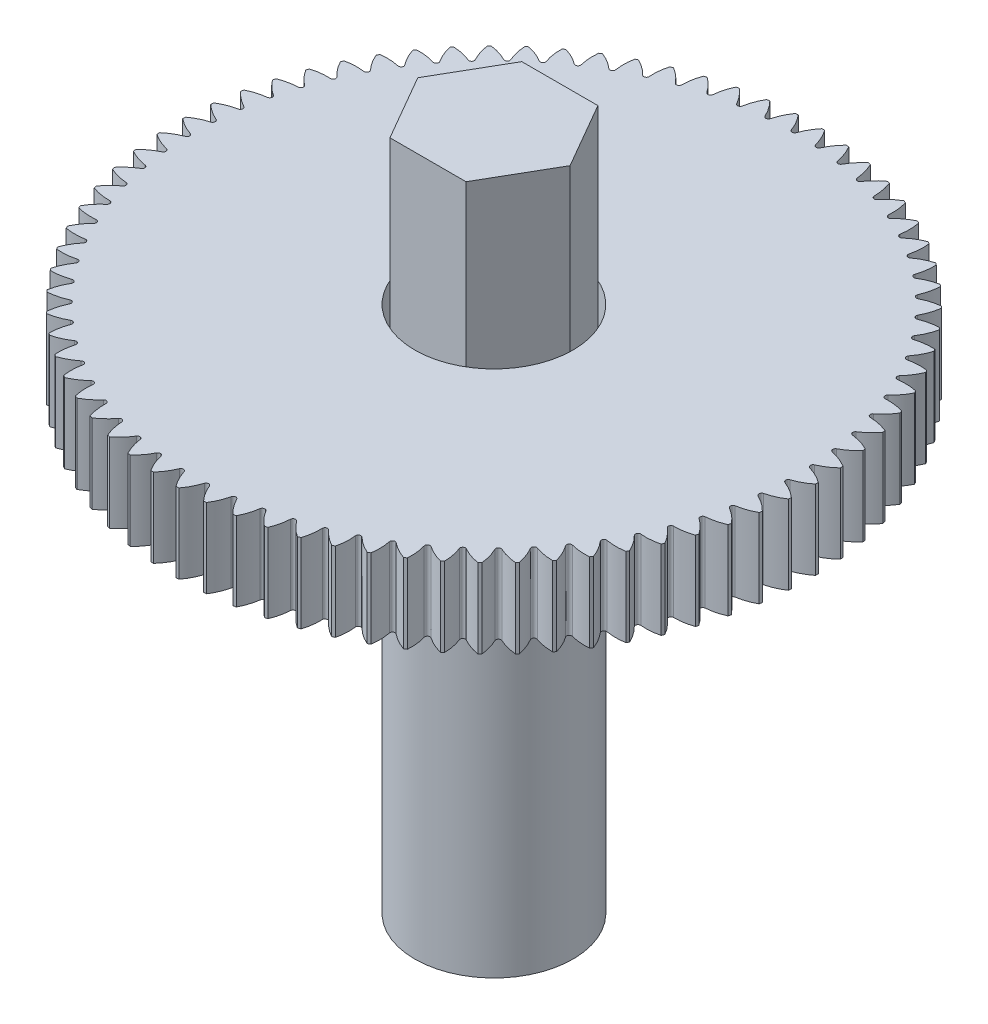
from build123d import *

# Parameters (mm, degrees)
CUT_EXTRUDE1_DEPTH = 3
SKETCH7_R          = 3
CUT_EXTRUDE9_DEPTH = 9


with BuildPart() as part:
    # Sketch1 → Revolve1 (revolve)
    with BuildSketch(Plane.XY, mode=Mode.PRIVATE) as revolve1_sk:
        Polygon((0, 13), (0, -13), (3, -13), (3, 4), (12, 4), (12, 7), (3, 7), (3, 13), align=None)
    revolve(revolve1_sk.sketch.rotate(Axis((0, 13, 0), (0, -1, 0)), 90), axis=Axis((0, 13, 0), (0, -1, 0)))

    # Sketch2 → Cut-Extrude1 (cut)
    with BuildSketch(Plane(origin=(0, 7, 0), x_dir=(1, 0, 0), z_dir=(0, 1, 0))):
        with BuildLine():
            ThreePointArc((-0.45, 11.991559532), (-0.244185037, 11.69752696), (-0.094236566, 11.371443523))
            ThreePointArc((-0.094236566, 11.371443523), (0, 11.304902), (0.094236566, 11.371443523))
            ThreePointArc((0.094236566, 11.371443523), (0.244185037, 11.69752696), (0.45, 11.991559532))
            ThreePointArc((0.45, 11.991559532), (0, 12), (-0.45, 11.991559532))
        make_face()
        with BuildLine():
            ThreePointArc((1.451849626, 11.911848415), (1.00413412, 11.957914311), (0.555006053, 11.987158474))
            ThreePointArc((0.555006053, 11.987158474), (0.735495183, 11.676934964), (0.857631805, 11.339447783))
            ThreePointArc((0.857631805, 11.339447783), (0.945969818, 11.265254118), (1.045443934, 11.323676758))
            ThreePointArc((1.045443934, 11.323676758), (1.222152474, 11.63606921), (1.451849626, 11.911848415))
        make_face()
        with BuildLine():
            ThreePointArc((2.443515571, 11.74858424), (2.001224961, 11.831952445), (1.556119138, 11.898676112))
            ThreePointArc((1.556119138, 11.898676112), (1.710016432, 11.574437659), (1.803484504, 11.227913964))
            ThreePointArc((1.803484504, 11.227913964), (1.885304338, 11.146588572), (1.989318265, 11.196482536))
            ThreePointArc((1.989318265, 11.196482536), (2.191547389, 11.492992794), (2.443515571, 11.74858424))
        make_face()
        with BuildLine():
            ThreePointArc((3.418042009, 11.502912189), (2.984278646, 11.622997934), (2.546317164, 11.726733087))
            ThreePointArc((2.546317164, 11.726733087), (2.672543145, 11.39075399), (2.736687056, 11.037624395))
            ThreePointArc((2.736687056, 11.037624395), (2.811414803, 10.949737716), (2.919238957, 10.990753033))
            ThreePointArc((2.919238957, 10.990753033), (3.145570175, 11.269301292), (3.418042009, 11.502912189))
        make_face()
        with BuildLine():
            ThreePointArc((4.368593339, 11.176555473), (3.946399761, 11.332516443), (3.518654606, 11.472535455))
            ThreePointArc((3.518654606, 11.472535455), (3.616323888, 11.127172366), (3.650693714, 10.769913822))
            ThreePointArc((3.650693714, 10.769913822), (3.717805213, 10.676082317), (3.828683286, 10.707931296))
            ThreePointArc((3.828683286, 10.707931296), (4.077529045, 10.966563737), (4.368593339, 11.176555473))
        make_face()
        with BuildLine():
            ThreePointArc((5.288502125, 10.771803251), (4.880839717, 10.962545492), (4.466311213, 11.13786623))
            ThreePointArc((4.466311213, 11.13786623), (4.534738717, 10.785541623), (4.539093379, 10.426660042))
            ThreePointArc((4.539093379, 10.426660042), (4.59811789, 10.327541871), (4.711272152, 10.350001113))
            ThreePointArc((4.711272152, 10.350001113), (4.980886979, 10.586903618), (5.288502125, 10.771803251))
        make_face()
        with BuildLine():
            ThreePointArc((6.171315869, 10.291494568), (5.781044089, 10.515680161), (5.382639857, 10.725072875))
            ThreePointArc((5.382639857, 10.725072875), (5.421345612, 10.368258054), (5.395654565, 10.010270733))
            ThreePointArc((5.395654565, 10.010270733), (5.446178074, 9.90656114), (5.560814829, 9.919473109))
            ThreePointArc((5.560814829, 9.919473109), (5.84930757, 10.132983977), (6.171315869, 10.291494568))
        make_face()
        with BuildLine():
            ThreePointArc((7.010842265, 9.738998446), (6.640698591, 9.995054889), (6.261213149, 10.23705084))
            ThreePointArc((6.261213149, 10.23705084), (6.269925663, 9.878248605), (6.214369111, 9.523666567))
            ThreePointArc((6.214369111, 9.523666567), (6.256037232, 9.416093), (6.371352386, 9.419367129))
            ThreePointArc((6.371352386, 9.419367129), (6.676699471, 9.607988733), (7.010842265, 9.738998446))
        make_face()
        with BuildLine():
            ThreePointArc((7.801192641, 9.118190247), (7.453773363, 9.404321488), (7.095868529, 9.677223249))
            ThreePointArc((7.095868529, 9.677223249), (7.074526691, 9.318950339), (6.989494323, 8.970260723))
            ThreePointArc((6.989494323, 8.970260723), (7.022014784, 8.859577733), (7.137199483, 8.853191056))
            ThreePointArc((7.137199483, 8.853191056), (7.457259122, 9.015600352), (7.801192641, 9.118190247))
        make_face()
        with BuildLine():
            ThreePointArc((8.536823255, 8.433424495), (8.214565271, 8.747623529), (7.880751491, 9.04951689))
            ThreePointArc((7.880751491, 9.04951689), (7.829504996, 8.694286333), (7.715593254, 8.353934945))
            ThreePointArc((7.715593254, 8.353934945), (7.738737947, 8.240918894), (7.852984254, 8.224916209))
            ThreePointArc((7.852984254, 8.224916209), (8.185511458, 8.359974012), (8.536823255, 8.433424495))
        make_face()
        with BuildLine():
            ThreePointArc((9.212574188, 7.689504329), (8.917737906, 8.029567276), (8.610356642, 8.358334672))
            ThreePointArc((8.610356642, 8.358334672), (8.52956495, 8.008638155), (8.387572842, 7.679012316))
            ThreePointArc((8.387572842, 7.679012316), (8.401179424, 7.56445593), (8.513685983, 7.538949484))
            ThreePointArc((8.513685983, 7.538949484), (8.856348313, 7.645708461), (9.212574188, 7.689504329))
        make_face()
        with BuildLine():
            ThreePointArc((9.823705532, 6.891647816), (9.558359016, 7.255189378), (9.279566329, 7.608524742))
            ThreePointArc((9.279566329, 7.608524742), (9.169796134, 7.266815134), (9.000719633, 6.950226933))
            ThreePointArc((9.000719633, 6.950226933), (9.004692663, 6.834933743), (9.114670322, 6.800102445))
            ThreePointArc((9.114670322, 6.800102445), (9.465064248, 6.877813759), (9.823705532, 6.891647816))
        make_face()
        with BuildLine():
            ThreePointArc((10.365930641, 6.045451344), (10.131935106, 6.42992154), (9.883686525, 6.805346477))
            ThreePointArc((9.883686525, 6.805346477), (9.745707786, 6.474020626), (9.550732843, 6.172690701))
            ThreePointArc((9.550732843, 6.172690701), (9.545044454, 6.057469406), (9.651721797, 6.013557573))
            ThreePointArc((9.651721797, 6.013557573), (10.007389558, 6.061676135), (10.365930641, 6.045451344))
        make_face()
        with BuildLine():
            ThreePointArc((10.835446193, 5.156850375), (10.634442951, 5.559552421), (10.418479762, 5.954433597))
            ThreePointArc((10.418479762, 5.954433597), (10.253260301, 5.635815515), (10.033754524, 5.35185748))
            ThreePointArc((10.033754524, 5.35185748), (10.018444615, 5.237516274), (10.121073379, 5.184831916))
            ThreePointArc((10.121073379, 5.184831916), (10.47952022, 5.203020208), (10.835446193, 5.156850375))
        make_face()
        with BuildLine():
            ThreePointArc((11.228958876, 4.232077806), (11.062357819, 4.650187037), (10.880194848, 5.061754643))
            ThreePointArc((10.880194848, 5.061754643), (10.688893562, 4.758079208), (10.446396626, 4.493484823))
            ThreePointArc((10.446396626, 4.493484823), (10.421572586, 4.380825728), (10.519432903, 4.319738388))
            ThreePointArc((10.519432903, 4.319738388), (10.878144577, 4.307868833), (11.228958876, 4.232077806))
        make_face()
        with BuildLine():
            ThreePointArc((11.543708481, 3.277620252), (11.412678196, 3.708203932), (11.265593186, 4.133571117))
            ThreePointArc((11.265593186, 4.133571117), (11.049551914, 3.846968393), (10.785764762, 3.603593599))
            ThreePointArc((10.785764762, 3.603593599), (10.751600713, 3.493406838), (10.844006163, 3.424344999))
            ThreePointArc((10.844006163, 3.424344999), (11.200466566, 3.382500853), (11.543708481, 3.277620252))
        make_face()
        with BuildLine():
            ThreePointArc((11.777487264, 2.300172547), (11.682946834, 2.740210441), (11.571971481, 3.176393559))
            ThreePointArc((11.571971481, 3.176393559), (11.332705599, 2.90887386), (11.049478508, 2.688425755))
            ThreePointArc((11.049478508, 2.688425755), (11.006214086, 2.581484208), (11.092516511, 2.504932291))
            ThreePointArc((11.092516511, 2.504932291), (11.44422533, 2.433407059), (11.777487264, 2.300172547))
        make_face()
        with BuildLine():
            ThreePointArc((11.928655437, 1.306590784), (11.871267996, 1.752996343), (11.797180711, 2.196935883))
            ThreePointArc((11.797180711, 2.196935883), (11.536368496, 1.950375666), (11.235688101, 1.754400536))
            ThreePointArc((11.235688101, 1.754400536), (11.183626776, 1.651454322), (11.263220826, 1.567949282))
            ThreePointArc((11.263220826, 1.567949282), (11.607711076, 1.467244664), (11.928655437, 1.306590784))
        make_face()
        with BuildLine():
            ThreePointArc((11.996152662, 0.303844225), (11.976320741, 0.753486234), (11.939641194, 1.202068281))
            ThreePointArc((11.939641194, 1.202068281), (11.659112058, 0.978196988), (11.343087414, 0.808069458))
            ThreePointArc((11.343087414, 0.808069458), (11.282594358, 0.70984067), (11.35492174, 0.619968235))
            ThreePointArc((11.35492174, 0.619968235), (11.689777068, 0.490790602), (11.996152662, 0.303844225))
        make_face()
        with BuildLine():
            ThreePointArc((11.979505495, -0.701033582), (11.997368202, -0.251309039), (11.998353673, 0.198769033))
            ThreePointArc((11.998353673, 0.198769033), (11.700075325, -0.000843038), (11.37092312, -0.143929647))
            ThreePointArc((11.37092312, -0.143929647), (11.302422648, -0.236752004), (11.366976036, -0.332361443))
            ThreePointArc((11.366976036, -0.332361443), (11.689847674, -0.489106004), (11.979505495, -0.701033582))
        make_face()
        with BuildLine():
            ThreePointArc((11.878830705, -1.700994143), (11.934262744, -1.254341559), (11.972906322, -0.805924437))
            ThreePointArc((11.972906322, -0.805924437), (11.65897097, -0.979877152), (11.318999969, -1.094919189))
            ThreePointArc((11.318999969, -1.094919189), (11.242972564, -1.181684033), (11.299299162, -1.282359845))
            ThreePointArc((11.299299162, -1.282359845), (11.607922397, -1.465571883), (11.878830705, -1.700994143))
        make_face()
        with BuildLine():
            ThreePointArc((11.694834453, -2.689023452), (11.787447009, -2.248575775), (11.863477636, -1.804964926))
            ThreePointArc((11.863477636, -1.804964926), (11.536087312, -1.952038131), (11.187682167, -2.038228659))
            ThreePointArc((11.187682167, -2.038228659), (11.104661106, -2.118327398), (11.152365824, -2.223363413))
            ThreePointArc((11.152365824, -2.223363413), (11.444575885, -2.431757828), (11.694834453, -2.689023452))
        make_face()
        with BuildLine():
            ThreePointArc((11.428807339, -3.658191193), (11.557950802, -3.227037847), (11.670835178, -2.791344883))
            ThreePointArc((11.670835178, -2.791344883), (11.332286289, -2.910506965), (10.977890812, -2.96724142))
            ThreePointArc((10.977890812, -2.96724142), (10.888458428, -3.040112218), (10.927206652, -3.148771685))
            ThreePointArc((10.927206652, -3.148771685), (11.200953896, -3.380886739), (11.428807339, -3.658191193))
        make_face()
        with BuildLine():
            ThreePointArc((11.082615354, -4.601699352), (11.247383874, -4.182864568), (11.396330196, -3.758145561))
            ThreePointArc((11.396330196, -3.758145561), (11.04899742, -3.848560684), (10.691097442, -3.875441114))
            ThreePointArc((10.691097442, -3.875441114), (10.595881038, -3.940572835), (10.625400976, -4.052093586))
            ThreePointArc((10.625400976, -4.052093586), (10.878765263, -4.306301158), (11.082615354, -4.601699352))
        make_face()
        with BuildLine():
            ThreePointArc((10.658686784, -5.512929896), (10.85792463, -5.109351499), (11.041888147, -4.698585549))
            ThreePointArc((11.041888147, -4.698585549), (10.688207773, -4.759619515), (10.329313704, -4.756457373))
            ThreePointArc((10.329313704, -4.756457373), (10.228981155, -4.813393165), (10.249065747, -4.926992961))
            ThreePointArc((10.249065747, -4.926992961), (10.480269909, -5.201509969), (10.658686784, -5.512929896))
        make_face()
        with BuildLine():
            ThreePointArc((10.159995185, -6.385491198), (10.392304845, -6), (10.609995185, -5.606068334))
            ThreePointArc((10.609995185, -5.606068334), (10.252448028, -5.637293035), (9.895077252, -5.604110502))
            ThreePointArc((9.895077252, -5.604110502), (9.790332319, -5.652451), (9.800840686, -5.767333022))
            ThreePointArc((9.800840686, -5.767333022), (10.008262991, -6.060233925), (10.159995185, -6.385491198))
        make_face()
        with BuildLine():
            ThreePointArc((9.59003852, -7.213262866), (9.85379051, -6.848562812), (10.103680731, -6.474228578))
            ThreePointArc((10.103680731, -6.474228578), (9.744774726, -6.475424995), (9.391433942, -6.412454821))
            ThreePointArc((9.391433942, -6.412454821), (9.283011337, -6.451860953), (9.283869769, -6.567219384))
            ThreePointArc((9.283869769, -6.567219384), (9.466055299, -6.876449695), (9.59003852, -7.213262866))
        make_face()
        with BuildLine():
            ThreePointArc((8.952814625, -7.990438679), (9.246158913, -7.649087877), (9.526496216, -7.296976761))
            ThreePointArc((9.526496216, -7.296976761), (9.168748831, -7.268136501), (8.821916472, -7.175820378))
            ThreePointArc((8.821916472, -7.175820378), (8.710576699, -7.206015737), (8.701779176, -7.321041422))
            ThreePointArc((8.701779176, -7.321041422), (8.85745003, -7.64443211), (8.952814625, -7.990438679))
        make_face()
        with BuildLine():
            ThreePointArc((8.252793168, -8.711567306), (8.573672156, -8.395960086), (8.882490175, -8.068541894))
            ThreePointArc((8.882490175, -8.068541894), (8.528410751, -8.009867251), (8.190519596, -7.88885271))
            ThreePointArc((8.190519596, -7.88885271), (8.077043625, -7.909625498), (8.058651855, -8.023511614))
            ThreePointArc((8.058651855, -8.023511614), (8.186716114, -8.358794326), (8.252793168, -8.711567306))
        make_face()
        with BuildLine():
            ThreePointArc((7.494884297, -9.371590547), (7.841047248, -9.083940668), (8.176179847, -8.783512003))
            ThreePointArc((8.176179847, -8.783512003), (7.828251997, -8.695414538), (7.50167211, -8.546550409))
            ThreePointArc((7.50167211, -8.546550409), (7.386855893, -8.557754919), (7.358998881, -8.669702636))
            ThreePointArc((7.358998881, -8.669702636), (7.458558266, -9.014525607), (7.494884297, -9.371590547))
        make_face()
        with BuildLine():
            ThreePointArc((6.684404197, -9.965878814), (7.053423028, -9.708203932), (7.412519492, -9.436872087))
            ThreePointArc((7.412519492, -9.436872087), (7.07318368, -9.31996974), (6.760205783, -9.144300197))
            ThreePointArc((6.760205783, -9.144300197), (6.644854674, -9.145857838), (6.607727817, -9.255081924))
            ThreePointArc((6.607727817, -9.255081924), (6.678083991, -9.607026467), (6.684404197, -9.965878814))
        make_face()
        with BuildLine():
            ThreePointArc((5.827037805, -10.490263601), (6.216324112, -10.264371122), (6.596865639, -10.024039293))
            ThreePointArc((6.596865639, -10.024039293), (6.268502062, -9.87915205), (5.971321471, -9.67790929))
            ThreePointArc((5.971321471, -9.67790929), (5.856244574, -9.669809136), (5.81010829, -9.775543463))
            ThreePointArc((5.81010829, -9.775543463), (5.850767755, -10.132140939), (5.827037805, -10.490263601))
        make_face()
        with BuildLine():
            ThreePointArc((4.928798929, -10.941066727), (5.33562215, -10.748541123), (5.734939513, -10.540895065))
            ThreePointArc((5.734939513, -10.540895065), (5.419851405, -10.369039207), (5.140552629, -10.143634802))
            ThreePointArc((5.140552629, -10.143634802), (5.026557127, -10.12593367), (4.971735028, -10.227436587))
            ThreePointArc((4.971735028, -10.227436587), (4.982412587, -10.586185722), (4.928798929, -10.941066727))
        make_face()
        with BuildLine():
            ThreePointArc((3.99598807, -11.31512613), (4.417494632, -11.157317831), (4.832786907, -10.983814033))
            ThreePointArc((4.832786907, -10.983814033), (4.533184385, -10.786195003), (4.273726503, -10.538210005))
            ThreePointArc((4.273726503, -10.538210005), (4.161611992, -10.511032055), (4.098488617, -10.607591592))
            ThreePointArc((4.098488617, -10.607591592), (4.079109374, -10.965976018), (3.99598807, -11.31512613))
        make_face()
        with BuildLine():
            ThreePointArc((3.035148226, -11.609818054), (3.468381563, -11.48783397), (3.896735773, -11.349689437))
            ThreePointArc((3.896735773, -11.349689437), (3.614720334, -11.127693392), (3.376923257, -10.858867236))
            ThreePointArc((3.376923257, -10.858867236), (3.267476139, -10.822403102), (3.196494254, -10.913341964))
            ThreePointArc((3.196494254, -10.913341964), (3.14719414, -11.268847872), (3.035148226, -11.609818054))
        make_face()
        with BuildLine():
            ThreePointArc((2.053018997, -11.823075446), (2.49494029, -11.737771209), (2.933351838, -11.635954924))
            ThreePointArc((2.933351838, -11.635954924), (2.670901617, -11.391139007), (2.456433321, -11.103357315))
            ThreePointArc((2.456433321, -11.103357315), (2.350421289, -11.057862768), (2.272078779, -11.142543083))
            ThreePointArc((2.272078779, -11.142543083), (2.193203601, -11.492676855), (2.053018997, -11.823075446))
        make_face()
        with BuildLine():
            ThreePointArc((1.056489316, -11.953402458), (1.503998803, -11.905376416), (1.949392547, -11.840602548))
            ThreePointArc((1.949392547, -11.840602548), (1.708348443, -11.574683966), (1.518713269, -11.269965321))
            ThreePointArc((1.518713269, -11.269965321), (1.416879923, -11.215759471), (1.331726305, -11.293587268))
            ThreePointArc((1.331726305, -11.293587268), (1.223829314, -11.635892967), (1.056489316, -11.953402458))
        make_face()
        with BuildLine():
            ThreePointArc((0.052549121, -11.999884941), (0.502507845, -11.989473961), (0.951759668, -11.962196852))
            ThreePointArc((0.951759668, -11.962196852), (0.733812434, -11.677040834), (0.570340536, -11.357522618))
            ThreePointArc((0.570340536, -11.357522618), (0.473400162, -11.29498568), (0.382032727, -11.365415053))
            ThreePointArc((0.382032727, -11.365415053), (0.245870743, -11.69749165), (0.052549121, -11.999884941))
        make_face()
        with BuildLine():
            ThreePointArc((-0.951759668, -11.962196852), (-0.502507845, -11.989473961), (-0.052549121, -11.999884941))
            ThreePointArc((-0.052549121, -11.999884941), (-0.245870743, -11.69749165), (-0.382032727, -11.365415053))
            ThreePointArc((-0.382032727, -11.365415053), (-0.473400162, -11.29498568), (-0.570340536, -11.357522618))
            ThreePointArc((-0.570340536, -11.357522618), (-0.733812434, -11.677040834), (-0.951759668, -11.962196852))
        make_face()
        with BuildLine():
            ThreePointArc((-1.949392547, -11.840602548), (-1.503998803, -11.905376416), (-1.056489316, -11.953402458))
            ThreePointArc((-1.056489316, -11.953402458), (-1.223829314, -11.635892967), (-1.331726305, -11.293587268))
            ThreePointArc((-1.331726305, -11.293587268), (-1.416879923, -11.215759471), (-1.518713269, -11.269965321))
            ThreePointArc((-1.518713269, -11.269965321), (-1.708348443, -11.574683966), (-1.949392547, -11.840602548))
        make_face()
        with BuildLine():
            ThreePointArc((-2.933351838, -11.635954924), (-2.49494029, -11.737771209), (-2.053018997, -11.823075446))
            ThreePointArc((-2.053018997, -11.823075446), (-2.193203601, -11.492676855), (-2.272078779, -11.142543083))
            ThreePointArc((-2.272078779, -11.142543083), (-2.350421289, -11.057862768), (-2.456433321, -11.103357315))
            ThreePointArc((-2.456433321, -11.103357315), (-2.670901617, -11.391139007), (-2.933351838, -11.635954924))
        make_face()
        with BuildLine():
            ThreePointArc((-3.896735773, -11.349689437), (-3.468381563, -11.48783397), (-3.035148226, -11.609818054))
            ThreePointArc((-3.035148226, -11.609818054), (-3.14719414, -11.268847872), (-3.196494254, -10.913341964))
            ThreePointArc((-3.196494254, -10.913341964), (-3.267476139, -10.822403102), (-3.376923257, -10.858867236))
            ThreePointArc((-3.376923257, -10.858867236), (-3.614720334, -11.127693392), (-3.896735773, -11.349689437))
        make_face()
        with BuildLine():
            ThreePointArc((-4.832786907, -10.983814033), (-4.417494632, -11.157317831), (-3.99598807, -11.31512613))
            ThreePointArc((-3.99598807, -11.31512613), (-4.079109374, -10.965976018), (-4.098488617, -10.607591592))
            ThreePointArc((-4.098488617, -10.607591592), (-4.161611992, -10.511032055), (-4.273726503, -10.538210005))
            ThreePointArc((-4.273726503, -10.538210005), (-4.533184385, -10.786195003), (-4.832786907, -10.983814033))
        make_face()
        with BuildLine():
            ThreePointArc((-5.734939513, -10.540895065), (-5.33562215, -10.748541123), (-4.928798929, -10.941066727))
            ThreePointArc((-4.928798929, -10.941066727), (-4.982412587, -10.586185722), (-4.971735028, -10.227436587))
            ThreePointArc((-4.971735028, -10.227436587), (-5.026557127, -10.12593367), (-5.140552629, -10.143634802))
            ThreePointArc((-5.140552629, -10.143634802), (-5.419851405, -10.369039207), (-5.734939513, -10.540895065))
        make_face()
        with BuildLine():
            ThreePointArc((-6.596865639, -10.024039293), (-6.216324112, -10.264371122), (-5.827037805, -10.490263601))
            ThreePointArc((-5.827037805, -10.490263601), (-5.850767755, -10.132140939), (-5.81010829, -9.775543463))
            ThreePointArc((-5.81010829, -9.775543463), (-5.856244574, -9.669809136), (-5.971321471, -9.67790929))
            ThreePointArc((-5.971321471, -9.67790929), (-6.268502062, -9.87915205), (-6.596865639, -10.024039293))
        make_face()
        with BuildLine():
            ThreePointArc((-7.412519492, -9.436872087), (-7.053423028, -9.708203932), (-6.684404197, -9.965878814))
            ThreePointArc((-6.684404197, -9.965878814), (-6.678083991, -9.607026467), (-6.607727817, -9.255081924))
            ThreePointArc((-6.607727817, -9.255081924), (-6.644854674, -9.145857838), (-6.760205783, -9.144300197))
            ThreePointArc((-6.760205783, -9.144300197), (-7.07318368, -9.31996974), (-7.412519492, -9.436872087))
        make_face()
        with BuildLine():
            ThreePointArc((-8.176179847, -8.783512003), (-7.841047248, -9.083940668), (-7.494884297, -9.371590547))
            ThreePointArc((-7.494884297, -9.371590547), (-7.458558266, -9.014525607), (-7.358998881, -8.669702636))
            ThreePointArc((-7.358998881, -8.669702636), (-7.386855893, -8.557754919), (-7.50167211, -8.546550409))
            ThreePointArc((-7.50167211, -8.546550409), (-7.828251997, -8.695414538), (-8.176179847, -8.783512003))
        make_face()
        with BuildLine():
            ThreePointArc((-8.882490175, -8.068541894), (-8.573672156, -8.395960086), (-8.252793168, -8.711567306))
            ThreePointArc((-8.252793168, -8.711567306), (-8.186716114, -8.358794326), (-8.058651855, -8.023511614))
            ThreePointArc((-8.058651855, -8.023511614), (-8.077043625, -7.909625498), (-8.190519596, -7.88885271))
            ThreePointArc((-8.190519596, -7.88885271), (-8.528410751, -8.009867251), (-8.882490175, -8.068541894))
        make_face()
        with BuildLine():
            ThreePointArc((-9.526496216, -7.296976761), (-9.246158913, -7.649087877), (-8.952814625, -7.990438679))
            ThreePointArc((-8.952814625, -7.990438679), (-8.85745003, -7.64443211), (-8.701779176, -7.321041422))
            ThreePointArc((-8.701779176, -7.321041422), (-8.710576699, -7.206015737), (-8.821916472, -7.175820378))
            ThreePointArc((-8.821916472, -7.175820378), (-9.168748831, -7.268136501), (-9.526496216, -7.296976761))
        make_face()
        with BuildLine():
            ThreePointArc((-10.103680731, -6.474228578), (-9.85379051, -6.848562812), (-9.59003852, -7.213262866))
            ThreePointArc((-9.59003852, -7.213262866), (-9.466055299, -6.876449695), (-9.283869769, -6.567219384))
            ThreePointArc((-9.283869769, -6.567219384), (-9.283011337, -6.451860953), (-9.391433942, -6.412454821))
            ThreePointArc((-9.391433942, -6.412454821), (-9.744774726, -6.475424995), (-10.103680731, -6.474228578))
        make_face()
        with BuildLine():
            ThreePointArc((-10.609995185, -5.606068334), (-10.392304845, -6), (-10.159995185, -6.385491198))
            ThreePointArc((-10.159995185, -6.385491198), (-10.008262991, -6.060233925), (-9.800840686, -5.767333022))
            ThreePointArc((-9.800840686, -5.767333022), (-9.790332319, -5.652451), (-9.895077252, -5.604110502))
            ThreePointArc((-9.895077252, -5.604110502), (-10.252448028, -5.637293035), (-10.609995185, -5.606068334))
        make_face()
        with BuildLine():
            ThreePointArc((-11.041888147, -4.698585549), (-10.85792463, -5.109351499), (-10.658686784, -5.512929896))
            ThreePointArc((-10.658686784, -5.512929896), (-10.480269909, -5.201509969), (-10.249065747, -4.926992961))
            ThreePointArc((-10.249065747, -4.926992961), (-10.228981155, -4.813393165), (-10.329313704, -4.756457373))
            ThreePointArc((-10.329313704, -4.756457373), (-10.688207773, -4.759619515), (-11.041888147, -4.698585549))
        make_face()
        with BuildLine():
            ThreePointArc((-11.396330196, -3.758145561), (-11.247383874, -4.182864568), (-11.082615354, -4.601699352))
            ThreePointArc((-11.082615354, -4.601699352), (-10.878765263, -4.306301158), (-10.625400976, -4.052093586))
            ThreePointArc((-10.625400976, -4.052093586), (-10.595881038, -3.940572835), (-10.691097442, -3.875441114))
            ThreePointArc((-10.691097442, -3.875441114), (-11.04899742, -3.848560684), (-11.396330196, -3.758145561))
        make_face()
        with BuildLine():
            ThreePointArc((-11.670835178, -2.791344883), (-11.557950802, -3.227037847), (-11.428807339, -3.658191193))
            ThreePointArc((-11.428807339, -3.658191193), (-11.200953896, -3.380886739), (-10.927206652, -3.148771685))
            ThreePointArc((-10.927206652, -3.148771685), (-10.888458428, -3.040112218), (-10.977890812, -2.96724142))
            ThreePointArc((-10.977890812, -2.96724142), (-11.332286289, -2.910506965), (-11.670835178, -2.791344883))
        make_face()
        with BuildLine():
            ThreePointArc((-11.863477636, -1.804964926), (-11.787447009, -2.248575775), (-11.694834453, -2.689023452))
            ThreePointArc((-11.694834453, -2.689023452), (-11.444575885, -2.431757828), (-11.152365824, -2.223363413))
            ThreePointArc((-11.152365824, -2.223363413), (-11.104661106, -2.118327398), (-11.187682167, -2.038228659))
            ThreePointArc((-11.187682167, -2.038228659), (-11.536087312, -1.952038131), (-11.863477636, -1.804964926))
        make_face()
        with BuildLine():
            ThreePointArc((-11.972906322, -0.805924437), (-11.934262744, -1.254341559), (-11.878830705, -1.700994143))
            ThreePointArc((-11.878830705, -1.700994143), (-11.607922397, -1.465571883), (-11.299299162, -1.282359845))
            ThreePointArc((-11.299299162, -1.282359845), (-11.242972564, -1.181684033), (-11.318999969, -1.094919189))
            ThreePointArc((-11.318999969, -1.094919189), (-11.65897097, -0.979877152), (-11.972906322, -0.805924437))
        make_face()
        with BuildLine():
            ThreePointArc((-11.998353673, 0.198769033), (-11.997368202, -0.251309039), (-11.979505495, -0.701033582))
            ThreePointArc((-11.979505495, -0.701033582), (-11.689847674, -0.489106004), (-11.366976036, -0.332361443))
            ThreePointArc((-11.366976036, -0.332361443), (-11.302422648, -0.236752004), (-11.37092312, -0.143929647))
            ThreePointArc((-11.37092312, -0.143929647), (-11.700075325, -0.000843038), (-11.998353673, 0.198769033))
        make_face()
        with BuildLine():
            ThreePointArc((-11.939641194, 1.202068281), (-11.976320741, 0.753486234), (-11.996152662, 0.303844225))
            ThreePointArc((-11.996152662, 0.303844225), (-11.689777068, 0.490790602), (-11.35492174, 0.619968235))
            ThreePointArc((-11.35492174, 0.619968235), (-11.282594358, 0.70984067), (-11.343087414, 0.808069458))
            ThreePointArc((-11.343087414, 0.808069458), (-11.659112058, 0.978196988), (-11.939641194, 1.202068281))
        make_face()
        with BuildLine():
            ThreePointArc((-11.797180711, 2.196935883), (-11.871267996, 1.752996343), (-11.928655437, 1.306590784))
            ThreePointArc((-11.928655437, 1.306590784), (-11.607711076, 1.467244664), (-11.263220826, 1.567949282))
            ThreePointArc((-11.263220826, 1.567949282), (-11.183626776, 1.651454322), (-11.235688101, 1.754400536))
            ThreePointArc((-11.235688101, 1.754400536), (-11.536368496, 1.950375666), (-11.797180711, 2.196935883))
        make_face()
        with BuildLine():
            ThreePointArc((-11.571971481, 3.176393559), (-11.682946834, 2.740210441), (-11.777487264, 2.300172547))
            ThreePointArc((-11.777487264, 2.300172547), (-11.44422533, 2.433407059), (-11.092516511, 2.504932291))
            ThreePointArc((-11.092516511, 2.504932291), (-11.006214086, 2.581484208), (-11.049478508, 2.688425755))
            ThreePointArc((-11.049478508, 2.688425755), (-11.332705599, 2.90887386), (-11.571971481, 3.176393559))
        make_face()
        with BuildLine():
            ThreePointArc((-11.265593186, 4.133571117), (-11.412678196, 3.708203932), (-11.543708481, 3.277620252))
            ThreePointArc((-11.543708481, 3.277620252), (-11.200466566, 3.382500853), (-10.844006163, 3.424344999))
            ThreePointArc((-10.844006163, 3.424344999), (-10.751600713, 3.493406838), (-10.785764762, 3.603593599))
            ThreePointArc((-10.785764762, 3.603593599), (-11.049551914, 3.846968393), (-11.265593186, 4.133571117))
        make_face()
        with BuildLine():
            ThreePointArc((-10.880194848, 5.061754643), (-11.062357819, 4.650187037), (-11.228958876, 4.232077806))
            ThreePointArc((-11.228958876, 4.232077806), (-10.878144577, 4.307868833), (-10.519432903, 4.319738388))
            ThreePointArc((-10.519432903, 4.319738388), (-10.421572586, 4.380825728), (-10.446396626, 4.493484823))
            ThreePointArc((-10.446396626, 4.493484823), (-10.688893562, 4.758079208), (-10.880194848, 5.061754643))
        make_face()
        with BuildLine():
            ThreePointArc((-10.418479762, 5.954433597), (-10.634442951, 5.559552421), (-10.835446193, 5.156850375))
            ThreePointArc((-10.835446193, 5.156850375), (-10.47952022, 5.203020208), (-10.121073379, 5.184831916))
            ThreePointArc((-10.121073379, 5.184831916), (-10.018444615, 5.237516274), (-10.033754524, 5.35185748))
            ThreePointArc((-10.033754524, 5.35185748), (-10.253260301, 5.635815515), (-10.418479762, 5.954433597))
        make_face()
        with BuildLine():
            ThreePointArc((-9.883686525, 6.805346477), (-10.131935106, 6.42992154), (-10.365930641, 6.045451344))
            ThreePointArc((-10.365930641, 6.045451344), (-10.007389558, 6.061676135), (-9.651721797, 6.013557573))
            ThreePointArc((-9.651721797, 6.013557573), (-9.545044454, 6.057469406), (-9.550732843, 6.172690701))
            ThreePointArc((-9.550732843, 6.172690701), (-9.745707786, 6.474020626), (-9.883686525, 6.805346477))
        make_face()
        with BuildLine():
            ThreePointArc((-9.279566329, 7.608524742), (-9.558359016, 7.255189378), (-9.823705532, 6.891647816))
            ThreePointArc((-9.823705532, 6.891647816), (-9.465064248, 6.877813759), (-9.114670322, 6.800102445))
            ThreePointArc((-9.114670322, 6.800102445), (-9.004692663, 6.834933743), (-9.000719633, 6.950226933))
            ThreePointArc((-9.000719633, 6.950226933), (-9.169796134, 7.266815134), (-9.279566329, 7.608524742))
        make_face()
        with BuildLine():
            ThreePointArc((-8.610356642, 8.358334672), (-8.917737906, 8.029567276), (-9.212574188, 7.689504329))
            ThreePointArc((-9.212574188, 7.689504329), (-8.856348313, 7.645708461), (-8.513685983, 7.538949484))
            ThreePointArc((-8.513685983, 7.538949484), (-8.401179424, 7.56445593), (-8.387572842, 7.679012316))
            ThreePointArc((-8.387572842, 7.679012316), (-8.52956495, 8.008638155), (-8.610356642, 8.358334672))
        make_face()
        with BuildLine():
            ThreePointArc((-7.880751491, 9.04951689), (-8.214565271, 8.747623529), (-8.536823255, 8.433424495))
            ThreePointArc((-8.536823255, 8.433424495), (-8.185511458, 8.359974012), (-7.852984254, 8.224916209))
            ThreePointArc((-7.852984254, 8.224916209), (-7.738737947, 8.240918894), (-7.715593254, 8.353934945))
            ThreePointArc((-7.715593254, 8.353934945), (-7.829504996, 8.694286333), (-7.880751491, 9.04951689))
        make_face()
        with BuildLine():
            ThreePointArc((-7.095868529, 9.677223249), (-7.453773363, 9.404321488), (-7.801192641, 9.118190247))
            ThreePointArc((-7.801192641, 9.118190247), (-7.457259122, 9.015600352), (-7.137199483, 8.853191056))
            ThreePointArc((-7.137199483, 8.853191056), (-7.022014784, 8.859577733), (-6.989494323, 8.970260723))
            ThreePointArc((-6.989494323, 8.970260723), (-7.074526691, 9.318950339), (-7.095868529, 9.677223249))
        make_face()
        with BuildLine():
            ThreePointArc((-6.261213149, 10.23705084), (-6.640698591, 9.995054889), (-7.010842265, 9.738998446))
            ThreePointArc((-7.010842265, 9.738998446), (-6.676699471, 9.607988733), (-6.371352386, 9.419367129))
            ThreePointArc((-6.371352386, 9.419367129), (-6.256037232, 9.416093), (-6.214369111, 9.523666567))
            ThreePointArc((-6.214369111, 9.523666567), (-6.269925663, 9.878248605), (-6.261213149, 10.23705084))
        make_face()
        with BuildLine():
            ThreePointArc((-5.382639857, 10.725072875), (-5.781044089, 10.515680161), (-6.171315869, 10.291494568))
            ThreePointArc((-6.171315869, 10.291494568), (-5.84930757, 10.132983977), (-5.560814829, 9.919473109))
            ThreePointArc((-5.560814829, 9.919473109), (-5.446178074, 9.90656114), (-5.395654565, 10.010270733))
            ThreePointArc((-5.395654565, 10.010270733), (-5.421345612, 10.368258054), (-5.382639857, 10.725072875))
        make_face()
        with BuildLine():
            ThreePointArc((-4.466311213, 11.13786623), (-4.880839717, 10.962545492), (-5.288502125, 10.771803251))
            ThreePointArc((-5.288502125, 10.771803251), (-4.980886979, 10.586903618), (-4.711272152, 10.350001113))
            ThreePointArc((-4.711272152, 10.350001113), (-4.59811789, 10.327541871), (-4.539093379, 10.426660042))
            ThreePointArc((-4.539093379, 10.426660042), (-4.534738717, 10.785541623), (-4.466311213, 11.13786623))
        make_face()
        with BuildLine():
            ThreePointArc((-3.518654606, 11.472535455), (-3.946399761, 11.332516443), (-4.368593339, 11.176555473))
            ThreePointArc((-4.368593339, 11.176555473), (-4.077529045, 10.966563737), (-3.828683286, 10.707931296))
            ThreePointArc((-3.828683286, 10.707931296), (-3.717805213, 10.676082317), (-3.650693714, 10.769913822))
            ThreePointArc((-3.650693714, 10.769913822), (-3.616323888, 11.127172366), (-3.518654606, 11.472535455))
        make_face()
        with BuildLine():
            ThreePointArc((-2.546317164, 11.726733087), (-2.984278646, 11.622997934), (-3.418042009, 11.502912189))
            ThreePointArc((-3.418042009, 11.502912189), (-3.145570175, 11.269301292), (-2.919238957, 10.990753033))
            ThreePointArc((-2.919238957, 10.990753033), (-2.811414803, 10.949737716), (-2.736687056, 11.037624395))
            ThreePointArc((-2.736687056, 11.037624395), (-2.672543145, 11.39075399), (-2.546317164, 11.726733087))
        make_face()
        with BuildLine():
            ThreePointArc((-1.556119138, 11.898676112), (-2.001224961, 11.831952445), (-2.443515571, 11.74858424))
            ThreePointArc((-2.443515571, 11.74858424), (-2.191547389, 11.492992794), (-1.989318265, 11.196482536))
            ThreePointArc((-1.989318265, 11.196482536), (-1.885304338, 11.146588572), (-1.803484504, 11.227913964))
            ThreePointArc((-1.803484504, 11.227913964), (-1.710016432, 11.574437659), (-1.556119138, 11.898676112))
        make_face()
        with BuildLine():
            ThreePointArc((-0.555006053, 11.987158474), (-1.00413412, 11.957914311), (-1.451849626, 11.911848415))
            ThreePointArc((-1.451849626, 11.911848415), (-1.222152474, 11.63606921), (-1.045443934, 11.323676758))
            ThreePointArc((-1.045443934, 11.323676758), (-0.945969818, 11.265254118), (-0.857631805, 11.339447783))
            ThreePointArc((-0.857631805, 11.339447783), (-0.735495183, 11.676934964), (-0.555006053, 11.987158474))
        make_face()
    extrude(amount=-CUT_EXTRUDE1_DEPTH, mode=Mode.SUBTRACT)

    # Sketch7 → Cut-Extrude9 (cut)
    with BuildSketch(Plane(origin=(0, 13, 0), x_dir=(1, 0, 0), z_dir=(0, 1, 0))):
        with Locations(Location((0, 0, 0), (0, 0, 270))):
            Circle(SKETCH7_R)
        Polygon((1.443375673, -2.5), (2.886751346, 0), (1.443375673, 2.5), (-1.443375673, 2.5), (-2.886751346, 0), (-1.443375673, -2.5), align=None, mode=Mode.SUBTRACT)
    extrude(amount=-CUT_EXTRUDE9_DEPTH, mode=Mode.SUBTRACT)


with BuildPart() as cut_extrude9_piece_1:
    # of the separate pieces the step leaves, piece 1, a body of its own (cut_extrude9_pieces)
    add(part.part.solids().sort_by_distance((-0.052549121, 4, 11.999884941))[0])


with BuildPart() as cut_extrude9_piece_2:
    # of the separate pieces the step leaves, piece 2, a body of its own (cut_extrude9_pieces)
    add(part.part.solids().sort_by_distance((0, -13, 3))[0])


solid = Compound([cut_extrude9_piece_1.part, cut_extrude9_piece_2.part])
